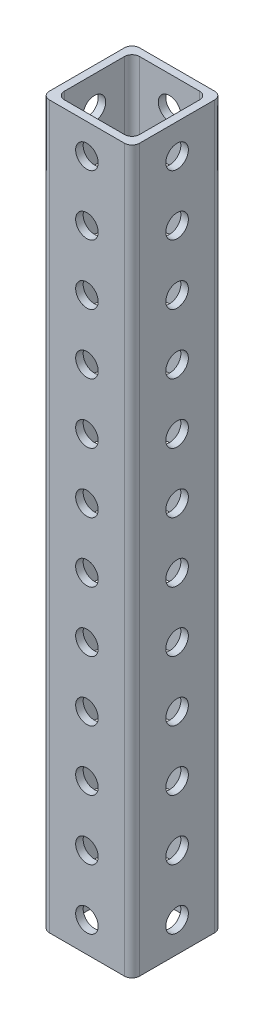
from build123d import *

# Parameters (mm, degrees)
SKETCH1_W           = 38.1
SKETCH1_H           = 38.1
SKETCH1_W_2         = 31.75
SKETCH1_H_2         = 31.75
BOSS_EXTRUDE1_DEPTH = 304.8
FILLET1_R           = 3.175
SKETCH2_R           = 4.7625
CUT_EXTRUDE1_DEPTH  = 310.525863217
SKETCH3_R           = 4.7625
CUT_EXTRUDE2_DEPTH  = 310.525863217


with BuildPart() as part:
    # Sketch1 → Boss-Extrude1 (new body)
    with BuildSketch(Plane(origin=(0, 0, 0), x_dir=(1, 0, 0), z_dir=(0, 1, 0))):
        with Locations((19.05, 19.05)):
            Rectangle(SKETCH1_W, SKETCH1_H)
        with Locations((19.05, 19.05)):
            Rectangle(SKETCH1_W_2, SKETCH1_H_2, mode=Mode.SUBTRACT)
    extrude(amount=BOSS_EXTRUDE1_DEPTH)

    # Fillet1
    fillet1_edges = [part.edges().sort_by_distance(p)[0] for p in [
        (3.175, 152.4, -34.925),
        (3.175, 152.4, -3.175),
        (34.925, 152.4, -3.175),
        (34.925, 152.4, -34.925),
        (0, 152.4, -38.1),
        (38.1, 152.4, -38.1),
        (38.1, 152.4, 0),
        (0, 152.4, 0),
    ]]
    fillet(fillet1_edges, radius=FILLET1_R)

    # Sketch2 → Cut-Extrude1 (cut, through all)
    with BuildSketch(Plane.XY):
        with Locations((19.05, 12.7)):
            Circle(SKETCH2_R)
        with Locations((19.05, 38.1)):
            Circle(SKETCH2_R)
        with Locations((19.05, 63.5)):
            Circle(SKETCH2_R)
        with Locations((19.05, 88.9)):
            Circle(SKETCH2_R)
        with Locations((19.05, 114.3)):
            Circle(SKETCH2_R)
        with Locations((19.05, 139.7)):
            Circle(SKETCH2_R)
        with Locations((19.05, 165.1)):
            Circle(SKETCH2_R)
        with Locations((19.05, 190.5)):
            Circle(SKETCH2_R)
        with Locations((19.05, 215.9)):
            Circle(SKETCH2_R)
        with Locations((19.05, 241.3)):
            Circle(SKETCH2_R)
        with Locations((19.05, 266.7)):
            Circle(SKETCH2_R)
        with Locations((19.05, 292.1)):
            Circle(SKETCH2_R)
    extrude(amount=-CUT_EXTRUDE1_DEPTH, mode=Mode.SUBTRACT)

    # Sketch3 → Cut-Extrude2 (cut, through all)
    with BuildSketch(Plane(origin=(38.1, 0, 0), x_dir=(0, 0, -1), z_dir=(1, 0, 0))):
        with Locations((19.05, 12.7)):
            Circle(SKETCH3_R)
        with Locations((19.05, 38.1)):
            Circle(SKETCH3_R)
        with Locations((19.05, 63.5)):
            Circle(SKETCH3_R)
        with Locations((19.05, 88.9)):
            Circle(SKETCH3_R)
        with Locations((19.05, 114.3)):
            Circle(SKETCH3_R)
        with Locations((19.05, 139.7)):
            Circle(SKETCH3_R)
        with Locations((19.05, 165.1)):
            Circle(SKETCH3_R)
        with Locations((19.05, 190.5)):
            Circle(SKETCH3_R)
        with Locations((19.05, 215.9)):
            Circle(SKETCH3_R)
        with Locations((19.05, 241.3)):
            Circle(SKETCH3_R)
        with Locations((19.05, 266.7)):
            Circle(SKETCH3_R)
        with Locations((19.05, 292.1)):
            Circle(SKETCH3_R)
    extrude(amount=-CUT_EXTRUDE2_DEPTH, mode=Mode.SUBTRACT)


solid = part.part
